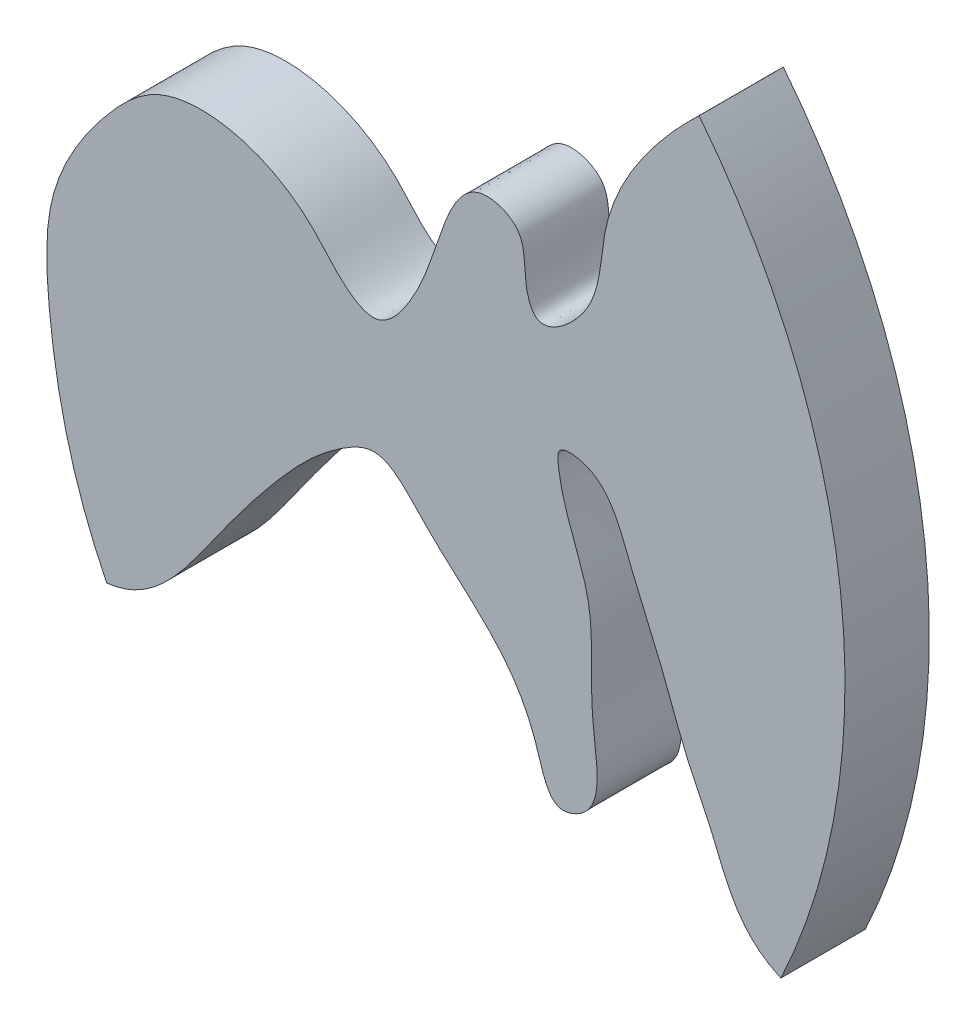
from build123d import *

# Parameters (mm, degrees)
BOSS_EXTRUDE1_DEPTH = 1.5875


with BuildPart() as part:
    # Sketch4 → Boss-Extrude1 (new body)
    with BuildSketch(Plane.XY):
        with BuildLine():
            ThreePointArc((28.22845584, 10.735967468), (29.129928498, 13.371145529), (29.43531497, 16.139458277))
            ThreePointArc((29.43531497, 16.139458277), (28.728458902, 20.317316414), (26.686575031, 24.030112445))
            add(Edge.make_bspline(
                [(15.530263626, 10.828286766), (14.893940081, 12.095087951), (14.438868342, 13.981262833), (14.343537675, 16.73425729), (15.269082011, 18.244723048), (16.506241707, 19.50741569), (18.140034136, 19.466216754), (19.332002745, 18.736180633), (19.902448165, 17.965467921), (20.681743122, 17.471570607), (21.448331705, 18.509031687), (21.733369869, 19.503537614), (22.291305084, 20.939072019), (23.514109208, 20.496889567), (23.332972834, 19.735543014), (23.678738278, 18.951349284), (24.892829136, 19.856633997), (24.704069783, 21.798562579), (25.937040799, 23.315779233), (26.686575031, 24.030112445)],
                knots=[0, 0, 0, 0, 0.163826768, 0.228294741, 0.314759461, 0.363733255, 0.427293954, 0.487534152, 0.520272147, 0.543412507, 0.580045633, 0.637017643, 0.689480468, 0.715613554, 0.754599818, 0.768000956, 0.802503201, 0.870835866, 1, 1, 1, 1], degree=3))
            add(Edge.make_bspline(
                [(15.530263626, 10.828286766), (15.626387534, 10.839761274), (16.489777481, 11.011623424), (17.499150898, 12.517877657), (18.687719037, 14.101458352), (19.657939915, 15.107245777), (20.736594209, 15.671140337), (21.592414385, 14.657430773), (22.718560515, 13.747508546), (23.569829513, 12.703280038), (23.862593949, 11.274580766), (24.95336238, 11.697819528), (24.5406586, 13.349786862), (24.808258039, 15.139757069), (24.095016856, 16.301161897), (23.99892435, 17.331566416), (24.934028737, 17.313329169), (25.368213122, 16.039497011), (25.991460724, 14.726460411), (26.406764207, 13.484600275), (27.128521052, 12.146063772), (27.369998366, 11.103966692), (28.22845584, 10.735967468)],
                knots=[0.291638302, 0.291638302, 0.291638302, 0.291638302, 0.299465828, 0.363653171, 0.418235104, 0.461509401, 0.476757706, 0.506042886, 0.54840923, 0.597041835, 0.622241463, 0.63200319, 0.675047866, 0.726967039, 0.779124266, 0.786558575, 0.795901318, 0.835776716, 0.878715553, 0.917236667, 0.938498416, 1, 1, 1, 1], degree=3))
        make_face()
    extrude(amount=BOSS_EXTRUDE1_DEPTH)


solid = part.part
